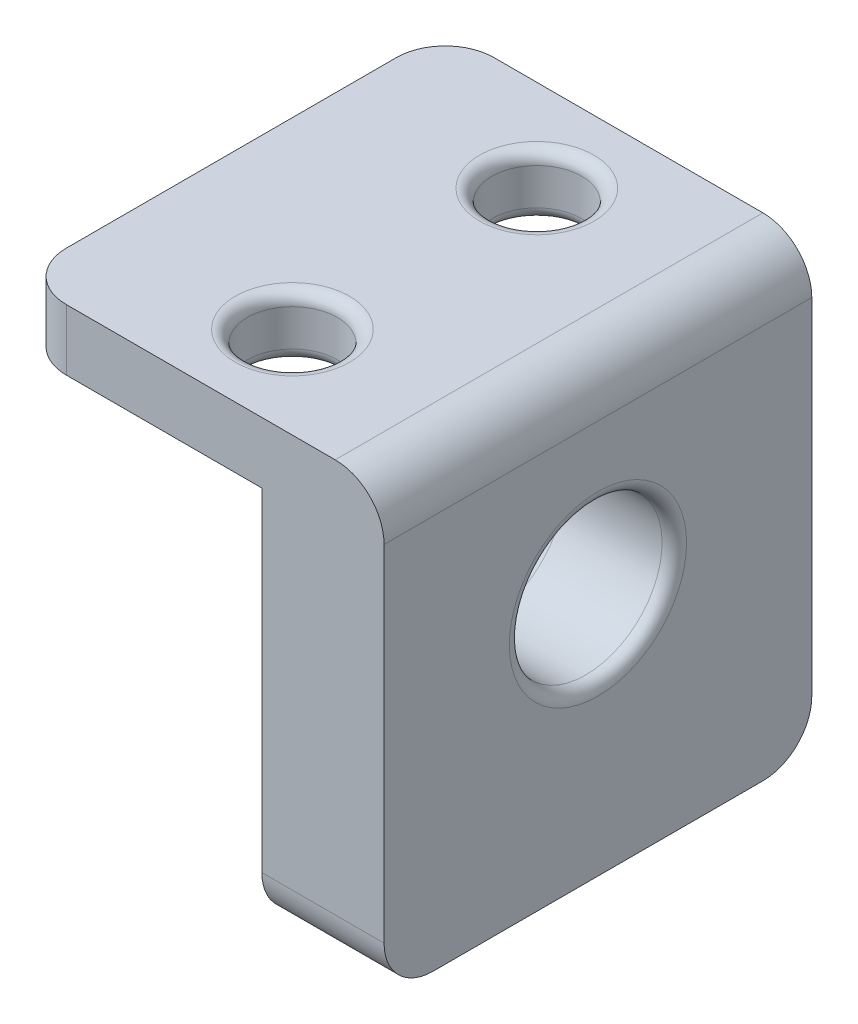
from build123d import *

# Parameters (mm, degrees)
BOSS_EXTRUDE1_DEPTH = 11.1125
SKETCH2_R           = 3.96875
CUT_EXTRUDE1_DEPTH  = 22.225
FILLET1_R           = 0.635
FILLET2_R           = 2.54
SKETCH3_R           = 2.3368
CUT_EXTRUDE2_DEPTH  = 22.225
FILLET3_R           = 0.635


with BuildPart() as part:
    # Sketch1 → Boss-Extrude1 (new, symmetric)
    with BuildSketch(Plane.XY):
        Polygon((0, -2.38125), (0, -5.55625), (12.7, -5.55625), (12.7, -25.4), (19.05, -25.4), (19.05, -2.38125), align=None)
    extrude(amount=BOSS_EXTRUDE1_DEPTH, both=True)

    # Sketch2 → Cut-Extrude1 (cut)
    with BuildSketch(Plane(origin=(19.05, 0, 0), x_dir=(0, 0, -1), z_dir=(1, 0, 0))):
        with Locations((0, -12.7)):
            Circle(SKETCH2_R)
    extrude(amount=-CUT_EXTRUDE1_DEPTH, mode=Mode.SUBTRACT)

    # Fillet1
    fillet1_edges = [part.edges().sort_by_distance(p)[0] for p in [
        (12.7, -12.7, 3.96875),
        (19.05, -12.7, 3.96875),
    ]]
    fillet(fillet1_edges, radius=FILLET1_R)

    # Fillet2
    fillet2_edges = [part.edges().sort_by_distance(p)[0] for p in [
        (19.05, -2.38125, 0),
        (15.875, -25.4, 11.1125),
        (15.875, -25.4, -11.1125),
        (0, -3.96875, -11.1125),
        (0, -3.96875, 11.1125),
    ]]
    fillet(fillet2_edges, radius=FILLET2_R)

    # Sketch3 → Cut-Extrude2 (cut)
    with BuildSketch(Plane(origin=(0, -2.38125, 0), x_dir=(1, 0, 0), z_dir=(0, 1, 0))):
        with Locations(Location((9.525, 6.35, 0), (0, 0, 180))):
            Circle(SKETCH3_R)
        with Locations(Location((9.525, -6.35, 0), (0, 0, 180))):
            Circle(SKETCH3_R)
    extrude(amount=-CUT_EXTRUDE2_DEPTH, mode=Mode.SUBTRACT)

    # Fillet3
    fillet3_edges = [part.edges().sort_by_distance(p)[0] for p in [
        (11.8618, -5.55625, -6.35),
        (11.8618, -2.38125, -6.35),
        (11.8618, -5.55625, 6.35),
        (11.8618, -2.38125, 6.35),
    ]]
    fillet(fillet3_edges, radius=FILLET3_R)


solid = part.part
